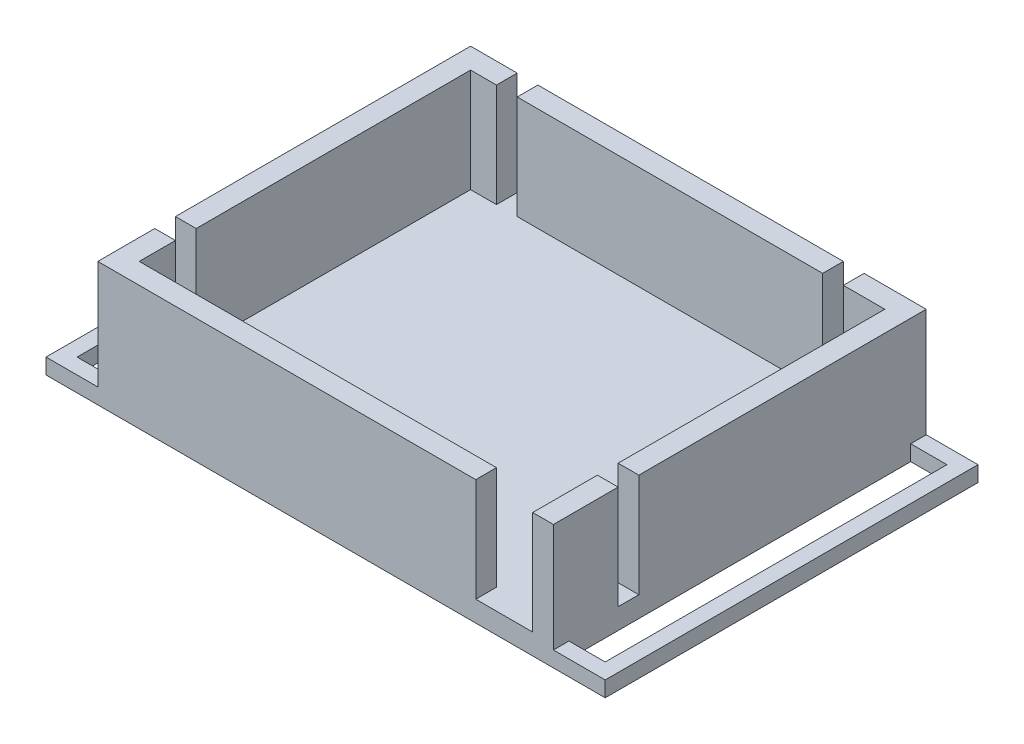
from build123d import *

# Parameters (mm, degrees)
SKETCH1_W           = 80
SKETCH1_H           = 64
BOSS_EXTRUDE1_DEPTH = 20
SHELL1_T            = 4
SKETCH2_W           = 4
SKETCH2_H           = 4
SKETCH2_W_2         = 11
CUT_EXTRUDE1_DEPTH  = 20
SKETCH4_W           = 72
SKETCH4_H           = 3
BOSS_EXTRUDE3_DEPTH = 10
SKETCH3_W           = 72
SKETCH3_H           = 3
BOSS_EXTRUDE2_DEPTH = 10
SKETCH6_W           = 7
SKETCH6_H           = 66
CUT_EXTRUDE2_DEPTH  = 3


with BuildPart() as part:
    # Sketch1 → Boss-Extrude1 (new body)
    with BuildSketch(Plane(origin=(0, 0, 0), x_dir=(1, 0, 0), z_dir=(0, 1, 0))):
        Rectangle(SKETCH1_W, SKETCH1_H)
    extrude(amount=BOSS_EXTRUDE1_DEPTH)

    # Shell1
    shell1_openings = [part.faces().sort_by_distance(p)[0] for p in [
        (0, 20, 0),
    ]]
    offset(amount=SHELL1_T, openings=shell1_openings, kind=Kind.INTERSECTION)

    # Sketch2 → Cut-Extrude1 (cut)
    with BuildSketch(Plane(origin=(0, 20, 0), x_dir=(1, 0, 0), z_dir=(0, 1, 0))):
        with Locations((-42, -23)):
            Rectangle(SKETCH2_W, SKETCH2_H)
        with Locations((34.5, -34)):
            Rectangle(SKETCH2_W_2, SKETCH2_H)
        with Locations((42, -21.5)):
            Rectangle(SKETCH2_W, SKETCH2_H)
        with Locations((30, 34)):
            Rectangle(SKETCH2_W, SKETCH2_H)
        with Locations((-33, 34)):
            Rectangle(SKETCH2_W, SKETCH2_H)
    extrude(amount=-CUT_EXTRUDE1_DEPTH, mode=Mode.SUBTRACT)

    # Sketch4 → Boss-Extrude3 (add)
    with BuildSketch(Plane.ZY.offset(44)):
        with Locations((0, -2.5)):
            Rectangle(SKETCH4_W, SKETCH4_H)
    extrude(amount=BOSS_EXTRUDE3_DEPTH)

    # Sketch3 → Boss-Extrude2 (add)
    with BuildSketch(Plane(origin=(44, 0, 0), x_dir=(0, 0, -1), z_dir=(1, 0, 0))):
        with Locations((0, -2.5)):
            Rectangle(SKETCH3_W, SKETCH3_H)
    extrude(amount=BOSS_EXTRUDE2_DEPTH)

    # Sketch6 → Cut-Extrude2 (cut)
    with BuildSketch(Plane(origin=(0, -1, 0), x_dir=(1, 0, 0), z_dir=(0, 1, 0))):
        with Locations((-47.5, 0)):
            Rectangle(SKETCH6_W, SKETCH6_H)
        with Locations((47.5, 0)):
            Rectangle(SKETCH6_W, SKETCH6_H)
    extrude(amount=-CUT_EXTRUDE2_DEPTH, mode=Mode.SUBTRACT)


solid = part.part
